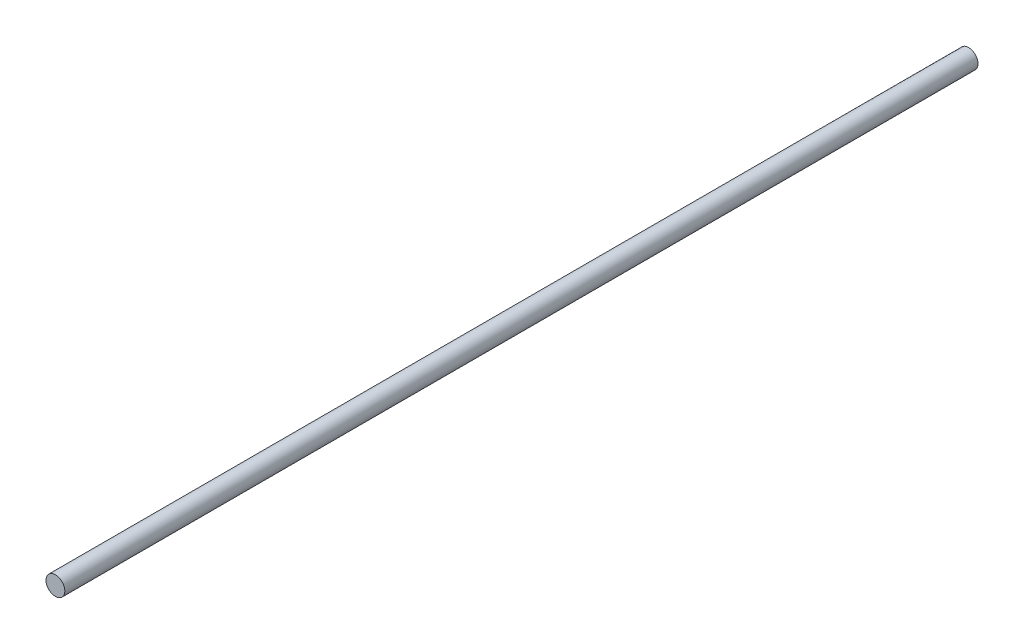
from build123d import *

# Parameters (mm, degrees)
IZIM1_R                     = 6
Y_KSEKLIK_EKSTR_ZYON1_DEPTH = 582


with BuildPart() as part:
    # Çizim1 → Yükseklik-Ekstrüzyon1 (new body)
    with BuildSketch(Plane.XY):
        Circle(IZIM1_R)
    extrude(amount=Y_KSEKLIK_EKSTR_ZYON1_DEPTH)


solid = part.part
